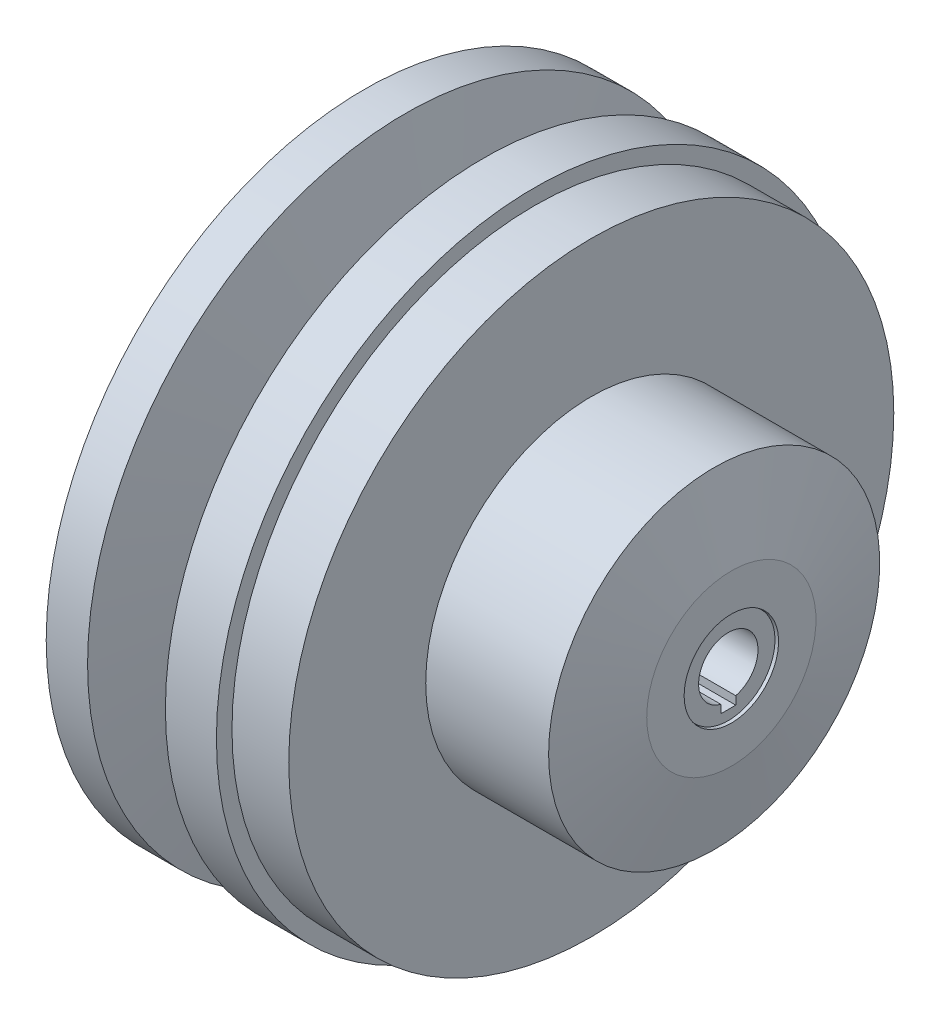
from build123d import *

# Parameters (mm, degrees)
SKETCH2_R          = 15.125
CUT_EXTRUDE5_DEPTH = 24.4
CUT_EXTRUDE6_REACH = 175.705
SKETCH3_R          = 9.543
CUT_EXTRUDE7_REACH = 190.351
SKETCH4_W          = 4.8
SKETCH4_H          = 4.648


with BuildPart() as part:
    # Sketch1 → Revolve1 (revolve)
    with BuildSketch(Plane.XY, mode=Mode.PRIVATE) as revolve1_sk:
        Polygon((-162.990125159, 0), (-162.990125159, 16.125), (-163.990125159, 16.125), (-163.990125159, 37.741454009), (-160.123125159, 37.741454009), (-160.123125159, 102.18499912), (-146.834181255, 102.18499912), (-134.834181255, 30), (-133.834181255, 30), (-121.834181255, 102.18499912), (-105.445019466, 102.18499912), (-105.445019466, 97.18499912), (-87.20655247, 97.18499912), (-87.20655247, 53.18499912), (-47.733023073, 53.18499912), (-42.20655247, 27.18499912), (-42.20655247, 15.17389025), (-43.190125159, 14.993377744), (-43.190125159, 0), align=None)
    revolve(revolve1_sk.sketch.rotate(Axis((-162.990125159, 0, 0), (1, 0, 0)), 90), axis=Axis((-162.990125159, 0, 0), (1, 0, 0)))

    # Sketch2 → Cut-Extrude5 (cut)
    with BuildSketch(Plane.ZY.offset(162.990125159)):
        Circle(SKETCH2_R)
    extrude(amount=-CUT_EXTRUDE5_DEPTH, mode=Mode.SUBTRACT)

    # Sketch3 → Cut-Extrude6 (cut, up to next)
    with BuildSketch(Plane.ZY.offset(138.590125159), mode=Mode.PRIVATE) as cut_extrude6_sk1:
        Circle(SKETCH3_R)
    cut_extrude6_tool1 = extrude(cut_extrude6_sk1.sketch, amount=-CUT_EXTRUDE6_REACH, mode=Mode.PRIVATE) & part.part
    add(cut_extrude6_tool1.solids().sort_by_distance((-138.590125, 0, 0))[0], mode=Mode.SUBTRACT)

    # Sketch4 → Cut-Extrude7 (cut, up to next)
    with BuildSketch(Plane(origin=(-43.190125159, 0, 0), x_dir=(0, 0, -1), z_dir=(1, 0, 0)), mode=Mode.PRIVATE) as cut_extrude7_sk1:
        with Locations((0, -9.543)):
            Rectangle(SKETCH4_W, SKETCH4_H)
    cut_extrude7_tool1 = extrude(cut_extrude7_sk1.sketch, amount=-CUT_EXTRUDE7_REACH, mode=Mode.PRIVATE) & part.part
    add(cut_extrude7_tool1.solids().sort_by_distance((-43.190125, -9.543, 0))[0], mode=Mode.SUBTRACT)


solid = part.part
